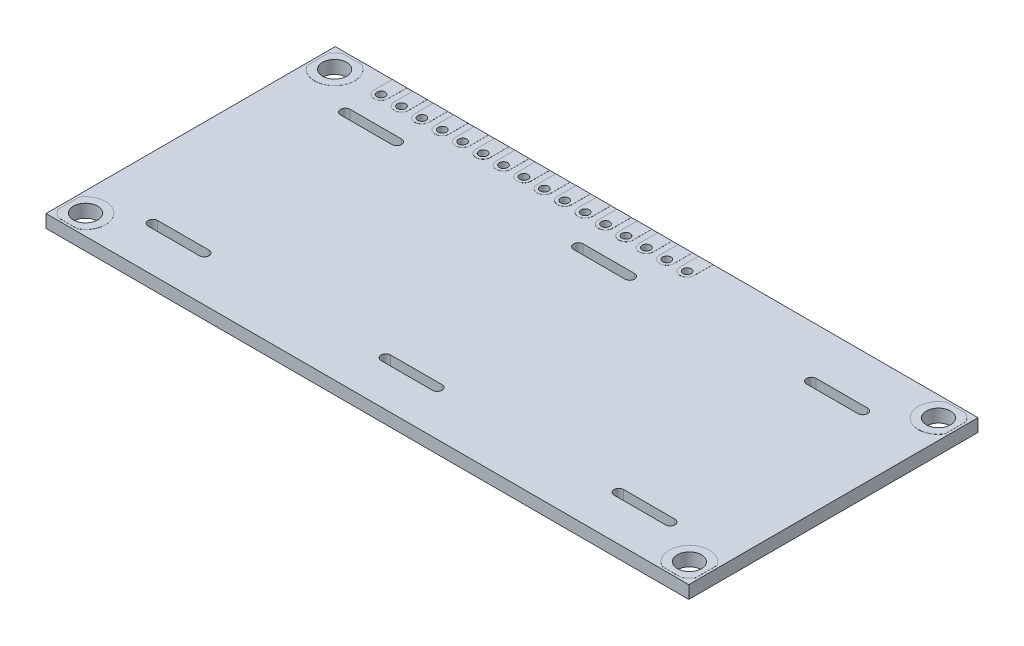
from build123d import *

# Parameters (mm, degrees)
ESQUISSE1_W        = 80
ESQUISSE1_H        = 36
ESQUISSE1_R        = 1.5
ESQUISSE1_R_2      = 0.52
BOSS_EXTRU_1_DEPTH = 1.6
ESQUISSE2_R        = 1.5
ESQUISSE2_R_2      = 0.52
BOSS_EXTRU_2_DEPTH = 0.01
BOSS_EXTRU_3_START = -1.61
ESQUISSE2_2_R      = 1.5
ESQUISSE2_2_R_2    = 0.52
BOSS_EXTRU_3_DEPTH = 0.01


with BuildPart() as part:
    # Esquisse1 → Boss.-Extru.1 (new body)
    with BuildSketch(Plane(origin=(0, 0, 0), x_dir=(1, 0, 0), z_dir=(0, 1, 0))):
        with Locations((40, 18)):
            Rectangle(ESQUISSE1_W, ESQUISSE1_H)
        with Locations(Location((2.42, 33.5, 0), (0, 0, 270))):
            Circle(ESQUISSE1_R, mode=Mode.SUBTRACT)
        with Locations(Location((2.42, 2.5, 0), (0, 0, 90))):
            Circle(ESQUISSE1_R, mode=Mode.SUBTRACT)
        with Locations(Location((77.58, 2.5, 0), (0, 0, 270))):
            Circle(ESQUISSE1_R, mode=Mode.SUBTRACT)
        with Locations(Location((77.58, 33.5, 0), (0, 0, 90))):
            Circle(ESQUISSE1_R, mode=Mode.SUBTRACT)
        with Locations(Location((8.02, 33.68, 0), (0, 0, 270))):
            Circle(ESQUISSE1_R_2, mode=Mode.SUBTRACT)
        with Locations(Location((10.56, 33.68, 0), (0, 0, 270))):
            Circle(ESQUISSE1_R_2, mode=Mode.SUBTRACT)
        with Locations(Location((13.1, 33.68, 0), (0, 0, 270))):
            Circle(ESQUISSE1_R_2, mode=Mode.SUBTRACT)
        with Locations(Location((15.64, 33.68, 0), (0, 0, 270))):
            Circle(ESQUISSE1_R_2, mode=Mode.SUBTRACT)
        with Locations(Location((18.18, 33.68, 0), (0, 0, 270))):
            Circle(ESQUISSE1_R_2, mode=Mode.SUBTRACT)
        with Locations(Location((20.72, 33.68, 0), (0, 0, 270))):
            Circle(ESQUISSE1_R_2, mode=Mode.SUBTRACT)
        with Locations(Location((23.26, 33.68, 0), (0, 0, 270))):
            Circle(ESQUISSE1_R_2, mode=Mode.SUBTRACT)
        with Locations(Location((25.8, 33.68, 0), (0, 0, 270))):
            Circle(ESQUISSE1_R_2, mode=Mode.SUBTRACT)
        with Locations(Location((28.34, 33.68, 0), (0, 0, 270))):
            Circle(ESQUISSE1_R_2, mode=Mode.SUBTRACT)
        with Locations(Location((30.88, 33.68, 0), (0, 0, 270))):
            Circle(ESQUISSE1_R_2, mode=Mode.SUBTRACT)
        with Locations(Location((33.42, 33.68, 0), (0, 0, 270))):
            Circle(ESQUISSE1_R_2, mode=Mode.SUBTRACT)
        with Locations(Location((35.96, 33.68, 0), (0, 0, 270))):
            Circle(ESQUISSE1_R_2, mode=Mode.SUBTRACT)
        with Locations(Location((38.5, 33.68, 0), (0, 0, 270))):
            Circle(ESQUISSE1_R_2, mode=Mode.SUBTRACT)
        with Locations(Location((41.04, 33.68, 0), (0, 0, 270))):
            Circle(ESQUISSE1_R_2, mode=Mode.SUBTRACT)
        with Locations(Location((43.58, 33.68, 0), (0, 0, 270))):
            Circle(ESQUISSE1_R_2, mode=Mode.SUBTRACT)
        with Locations(Location((46.12, 33.68, 0), (0, 0, 270))):
            Circle(ESQUISSE1_R_2, mode=Mode.SUBTRACT)
        with BuildLine():
            Line((7.7, 30.16), (14.1, 30.16))
            ThreePointArc((14.1, 30.16), (14.7, 29.56), (14.1, 28.96))
            Line((14.1, 28.96), (7.7, 28.96))
            ThreePointArc((7.7, 28.96), (7.1, 29.56), (7.7, 30.16))
        make_face(mode=Mode.SUBTRACT)
        with BuildLine():
            Line((7.7, 6.2), (14.1, 6.2))
            ThreePointArc((14.1, 6.2), (14.7, 5.6), (14.1, 5))
            Line((14.1, 5), (7.7, 5))
            ThreePointArc((7.7, 5), (7.1, 5.6), (7.7, 6.2))
        make_face(mode=Mode.SUBTRACT)
        with BuildLine():
            Line((36.7, 30.16), (43.1, 30.16))
            ThreePointArc((43.1, 30.16), (43.7, 29.56), (43.1, 28.96))
            Line((43.1, 28.96), (36.7, 28.96))
            ThreePointArc((36.7, 28.96), (36.1, 29.56), (36.7, 30.16))
        make_face(mode=Mode.SUBTRACT)
        with BuildLine():
            Line((36.7, 6.2), (43.1, 6.2))
            ThreePointArc((43.1, 6.2), (43.7, 5.6), (43.1, 5))
            Line((43.1, 5), (36.7, 5))
            ThreePointArc((36.7, 5), (36.1, 5.6), (36.7, 6.2))
        make_face(mode=Mode.SUBTRACT)
        with BuildLine():
            Line((65.7, 30.16), (72.1, 30.16))
            ThreePointArc((72.1, 30.16), (72.7, 29.56), (72.1, 28.96))
            Line((72.1, 28.96), (65.7, 28.96))
            ThreePointArc((65.7, 28.96), (65.1, 29.56), (65.7, 30.16))
        make_face(mode=Mode.SUBTRACT)
        with BuildLine():
            Line((65.7, 6.2), (72.1, 6.2))
            ThreePointArc((72.1, 6.2), (72.7, 5.6), (72.1, 5))
            Line((72.1, 5), (65.7, 5))
            ThreePointArc((65.7, 5), (65.1, 5.6), (65.7, 6.2))
        make_face(mode=Mode.SUBTRACT)
    extrude(amount=BOSS_EXTRU_1_DEPTH)

    # Esquisse2 → Boss.-Extru.2 (add)
    # profile 1 of 20: a face of its own
    with BuildSketch(Plane(origin=(0, 1.6, 0), x_dir=(1, 0, 0), z_dir=(0, 1, 0))):
        with BuildLine():
            Line((0.3, 32.175009434), (0.3, 34.824990566))
            ThreePointArc((0.3, 34.824990566), (0.709388811, 35.323131745), (1.232565791, 35.7))
            Line((1.232565791, 35.7), (3.607434209, 35.7))
            ThreePointArc((3.607434209, 35.7), (4.243131745, 31.789388811), (0.3, 32.175009434))
        make_face()
        with Locations(Location((2.42, 33.5, 0), (0, 0, 270))):
            Circle(ESQUISSE2_R, mode=Mode.SUBTRACT)
    # profile 2 of 20: a face of its own
    with BuildSketch(Plane(origin=(0, 1.6, 0), x_dir=(1, 0, 0), z_dir=(0, 1, 0))):
        with BuildLine():
            Line((7.12, 33.68), (7.12, 36))
            Line((7.12, 36), (8.92, 36))
            Line((8.92, 36), (8.92, 33.68))
            ThreePointArc((8.92, 33.68), (8.02, 32.78), (7.12, 33.68))
        make_face()
        with Locations(Location((8.02, 33.68, 0), (0, 0, 270))):
            Circle(ESQUISSE2_R_2, mode=Mode.SUBTRACT)
    # profile 3 of 20: a face of its own
    with BuildSketch(Plane(origin=(0, 1.6, 0), x_dir=(1, 0, 0), z_dir=(0, 1, 0))):
        with BuildLine():
            Line((3.607434209, 0.3), (1.232565791, 0.3))
            ThreePointArc((1.232565791, 0.3), (0.709388811, 0.676868255), (0.3, 1.175009434))
            Line((0.3, 1.175009434), (0.3, 3.824990566))
            ThreePointArc((0.3, 3.824990566), (4.243131745, 4.210611189), (3.607434209, 0.3))
        make_face()
        with Locations(Location((2.42, 2.5, 0), (0, 0, 90))):
            Circle(ESQUISSE2_R, mode=Mode.SUBTRACT)
    # profile 4 of 20: a face of its own
    with BuildSketch(Plane(origin=(0, 1.6, 0), x_dir=(1, 0, 0), z_dir=(0, 1, 0))):
        with BuildLine():
            Line((76.392565791, 0.3), (78.767434209, 0.3))
            ThreePointArc((78.767434209, 0.3), (79.290611189, 0.676868255), (79.7, 1.175009434))
            Line((79.7, 1.175009434), (79.7, 3.824990566))
            ThreePointArc((79.7, 3.824990566), (75.756868255, 4.210611189), (76.392565791, 0.3))
        make_face()
        with Locations(Location((77.58, 2.5, 0), (0, 0, 270))):
            Circle(ESQUISSE2_R, mode=Mode.SUBTRACT)
    # profile 5 of 20: a face of its own
    with BuildSketch(Plane(origin=(0, 1.6, 0), x_dir=(1, 0, 0), z_dir=(0, 1, 0))):
        with BuildLine():
            Line((79.7, 32.175009434), (79.7, 34.824990566))
            ThreePointArc((79.7, 34.824990566), (79.290611189, 35.323131745), (78.767434209, 35.7))
            Line((78.767434209, 35.7), (76.392565791, 35.7))
            ThreePointArc((76.392565791, 35.7), (75.756868255, 31.789388811), (79.7, 32.175009434))
        make_face()
        with Locations(Location((77.58, 33.5, 0), (0, 0, 90))):
            Circle(ESQUISSE2_R, mode=Mode.SUBTRACT)
    # profile 6 of 20: a face of its own
    with BuildSketch(Plane(origin=(0, 1.6, 0), x_dir=(1, 0, 0), z_dir=(0, 1, 0))):
        with BuildLine():
            Line((9.66, 33.68), (9.66, 36))
            Line((9.66, 36), (11.46, 36))
            Line((11.46, 36), (11.46, 33.68))
            ThreePointArc((11.46, 33.68), (10.56, 32.78), (9.66, 33.68))
        make_face()
        with Locations(Location((10.56, 33.68, 0), (0, 0, 270))):
            Circle(ESQUISSE2_R_2, mode=Mode.SUBTRACT)
    # profile 7 of 20: a face of its own
    with BuildSketch(Plane(origin=(0, 1.6, 0), x_dir=(1, 0, 0), z_dir=(0, 1, 0))):
        with BuildLine():
            Line((12.2, 33.68), (12.2, 36))
            Line((12.2, 36), (14, 36))
            Line((14, 36), (14, 33.68))
            ThreePointArc((14, 33.68), (13.1, 32.78), (12.2, 33.68))
        make_face()
        with Locations(Location((13.1, 33.68, 0), (0, 0, 270))):
            Circle(ESQUISSE2_R_2, mode=Mode.SUBTRACT)
    # profile 8 of 20: a face of its own
    with BuildSketch(Plane(origin=(0, 1.6, 0), x_dir=(1, 0, 0), z_dir=(0, 1, 0))):
        with BuildLine():
            Line((14.74, 33.68), (14.74, 36))
            Line((14.74, 36), (16.54, 36))
            Line((16.54, 36), (16.54, 33.68))
            ThreePointArc((16.54, 33.68), (15.64, 32.78), (14.74, 33.68))
        make_face()
        with Locations(Location((15.64, 33.68, 0), (0, 0, 270))):
            Circle(ESQUISSE2_R_2, mode=Mode.SUBTRACT)
    # profile 9 of 20: a face of its own
    with BuildSketch(Plane(origin=(0, 1.6, 0), x_dir=(1, 0, 0), z_dir=(0, 1, 0))):
        with BuildLine():
            Line((17.28, 33.68), (17.28, 36))
            Line((17.28, 36), (19.08, 36))
            Line((19.08, 36), (19.08, 33.68))
            ThreePointArc((19.08, 33.68), (18.18, 32.78), (17.28, 33.68))
        make_face()
        with Locations(Location((18.18, 33.68, 0), (0, 0, 270))):
            Circle(ESQUISSE2_R_2, mode=Mode.SUBTRACT)
    # profile 10 of 20: a face of its own
    with BuildSketch(Plane(origin=(0, 1.6, 0), x_dir=(1, 0, 0), z_dir=(0, 1, 0))):
        with BuildLine():
            Line((19.82, 33.68), (19.82, 36))
            Line((19.82, 36), (21.62, 36))
            Line((21.62, 36), (21.62, 33.68))
            ThreePointArc((21.62, 33.68), (20.72, 32.78), (19.82, 33.68))
        make_face()
        with Locations(Location((20.72, 33.68, 0), (0, 0, 270))):
            Circle(ESQUISSE2_R_2, mode=Mode.SUBTRACT)
    # profile 11 of 20: a face of its own
    with BuildSketch(Plane(origin=(0, 1.6, 0), x_dir=(1, 0, 0), z_dir=(0, 1, 0))):
        with BuildLine():
            Line((22.36, 33.68), (22.36, 36))
            Line((22.36, 36), (24.16, 36))
            Line((24.16, 36), (24.16, 33.68))
            ThreePointArc((24.16, 33.68), (23.26, 32.78), (22.36, 33.68))
        make_face()
        with Locations(Location((23.26, 33.68, 0), (0, 0, 270))):
            Circle(ESQUISSE2_R_2, mode=Mode.SUBTRACT)
    # profile 12 of 20: a face of its own
    with BuildSketch(Plane(origin=(0, 1.6, 0), x_dir=(1, 0, 0), z_dir=(0, 1, 0))):
        with BuildLine():
            Line((24.9, 33.68), (24.9, 36))
            Line((24.9, 36), (26.7, 36))
            Line((26.7, 36), (26.7, 33.68))
            ThreePointArc((26.7, 33.68), (25.8, 32.78), (24.9, 33.68))
        make_face()
        with Locations(Location((25.8, 33.68, 0), (0, 0, 270))):
            Circle(ESQUISSE2_R_2, mode=Mode.SUBTRACT)
    # profile 13 of 20: a face of its own
    with BuildSketch(Plane(origin=(0, 1.6, 0), x_dir=(1, 0, 0), z_dir=(0, 1, 0))):
        with BuildLine():
            Line((27.44, 33.68), (27.44, 36))
            Line((27.44, 36), (29.24, 36))
            Line((29.24, 36), (29.24, 33.68))
            ThreePointArc((29.24, 33.68), (28.34, 32.78), (27.44, 33.68))
        make_face()
        with Locations(Location((28.34, 33.68, 0), (0, 0, 270))):
            Circle(ESQUISSE2_R_2, mode=Mode.SUBTRACT)
    # profile 14 of 20: a face of its own
    with BuildSketch(Plane(origin=(0, 1.6, 0), x_dir=(1, 0, 0), z_dir=(0, 1, 0))):
        with BuildLine():
            Line((29.98, 33.68), (29.98, 36))
            Line((29.98, 36), (31.78, 36))
            Line((31.78, 36), (31.78, 33.68))
            ThreePointArc((31.78, 33.68), (30.88, 32.78), (29.98, 33.68))
        make_face()
        with Locations(Location((30.88, 33.68, 0), (0, 0, 270))):
            Circle(ESQUISSE2_R_2, mode=Mode.SUBTRACT)
    # profile 15 of 20: a face of its own
    with BuildSketch(Plane(origin=(0, 1.6, 0), x_dir=(1, 0, 0), z_dir=(0, 1, 0))):
        with BuildLine():
            Line((32.52, 33.68), (32.52, 36))
            Line((32.52, 36), (34.32, 36))
            Line((34.32, 36), (34.32, 33.68))
            ThreePointArc((34.32, 33.68), (33.42, 32.78), (32.52, 33.68))
        make_face()
        with Locations(Location((33.42, 33.68, 0), (0, 0, 270))):
            Circle(ESQUISSE2_R_2, mode=Mode.SUBTRACT)
    # profile 16 of 20: a face of its own
    with BuildSketch(Plane(origin=(0, 1.6, 0), x_dir=(1, 0, 0), z_dir=(0, 1, 0))):
        with BuildLine():
            Line((35.06, 33.68), (35.06, 36))
            Line((35.06, 36), (36.86, 36))
            Line((36.86, 36), (36.86, 33.68))
            ThreePointArc((36.86, 33.68), (35.96, 32.78), (35.06, 33.68))
        make_face()
        with Locations(Location((35.96, 33.68, 0), (0, 0, 270))):
            Circle(ESQUISSE2_R_2, mode=Mode.SUBTRACT)
    # profile 17 of 20: a face of its own
    with BuildSketch(Plane(origin=(0, 1.6, 0), x_dir=(1, 0, 0), z_dir=(0, 1, 0))):
        with BuildLine():
            Line((37.6, 33.68), (37.6, 36))
            Line((37.6, 36), (39.4, 36))
            Line((39.4, 36), (39.4, 33.68))
            ThreePointArc((39.4, 33.68), (38.5, 32.78), (37.6, 33.68))
        make_face()
        with Locations(Location((38.5, 33.68, 0), (0, 0, 270))):
            Circle(ESQUISSE2_R_2, mode=Mode.SUBTRACT)
    # profile 18 of 20: a face of its own
    with BuildSketch(Plane(origin=(0, 1.6, 0), x_dir=(1, 0, 0), z_dir=(0, 1, 0))):
        with BuildLine():
            Line((40.14, 33.68), (40.14, 36))
            Line((40.14, 36), (41.94, 36))
            Line((41.94, 36), (41.94, 33.68))
            ThreePointArc((41.94, 33.68), (41.04, 32.78), (40.14, 33.68))
        make_face()
        with Locations(Location((41.04, 33.68, 0), (0, 0, 270))):
            Circle(ESQUISSE2_R_2, mode=Mode.SUBTRACT)
    # profile 19 of 20: a face of its own
    with BuildSketch(Plane(origin=(0, 1.6, 0), x_dir=(1, 0, 0), z_dir=(0, 1, 0))):
        with BuildLine():
            Line((42.68, 33.68), (42.68, 36))
            Line((42.68, 36), (44.48, 36))
            Line((44.48, 36), (44.48, 33.68))
            ThreePointArc((44.48, 33.68), (43.58, 32.78), (42.68, 33.68))
        make_face()
        with Locations(Location((43.58, 33.68, 0), (0, 0, 270))):
            Circle(ESQUISSE2_R_2, mode=Mode.SUBTRACT)
    # profile 20 of 20: a face of its own
    with BuildSketch(Plane(origin=(0, 1.6, 0), x_dir=(1, 0, 0), z_dir=(0, 1, 0))):
        with BuildLine():
            Line((45.22, 33.68), (45.22, 36))
            Line((45.22, 36), (47.02, 36))
            Line((47.02, 36), (47.02, 33.68))
            ThreePointArc((47.02, 33.68), (46.12, 32.78), (45.22, 33.68))
        make_face()
        with Locations(Location((46.12, 33.68, 0), (0, 0, 270))):
            Circle(ESQUISSE2_R_2, mode=Mode.SUBTRACT)
    extrude(amount=BOSS_EXTRU_2_DEPTH)

    # Esquisse2<2> → Boss.-Extru.3 (add)
    # profile 1 of 20: a face of its own
    with BuildSketch(Plane(origin=(0, 1.6, 0), x_dir=(1, 0, 0), z_dir=(0, 1, 0)).offset(BOSS_EXTRU_3_START)):
        with BuildLine():
            Line((0.3, 32.175009434), (0.3, 34.824990566))
            ThreePointArc((0.3, 34.824990566), (0.709388811, 35.323131745), (1.232565791, 35.7))
            Line((1.232565791, 35.7), (3.607434209, 35.7))
            ThreePointArc((3.607434209, 35.7), (4.243131745, 31.789388811), (0.3, 32.175009434))
        make_face()
        with Locations(Location((2.42, 33.5, 0), (0, 0, 90))):
            Circle(ESQUISSE2_2_R, mode=Mode.SUBTRACT)
    # profile 2 of 20: a face of its own
    with BuildSketch(Plane(origin=(0, 1.6, 0), x_dir=(1, 0, 0), z_dir=(0, 1, 0)).offset(BOSS_EXTRU_3_START)):
        with BuildLine():
            Line((7.12, 33.68), (7.12, 36))
            Line((7.12, 36), (8.92, 36))
            Line((8.92, 36), (8.92, 33.68))
            ThreePointArc((8.92, 33.68), (8.02, 32.78), (7.12, 33.68))
        make_face()
        with Locations(Location((8.02, 33.68, 0), (0, 0, 90))):
            Circle(ESQUISSE2_2_R_2, mode=Mode.SUBTRACT)
    # profile 3 of 20: a face of its own
    with BuildSketch(Plane(origin=(0, 1.6, 0), x_dir=(1, 0, 0), z_dir=(0, 1, 0)).offset(BOSS_EXTRU_3_START)):
        with BuildLine():
            Line((3.607434209, 0.3), (1.232565791, 0.3))
            ThreePointArc((1.232565791, 0.3), (0.709388811, 0.676868255), (0.3, 1.175009434))
            Line((0.3, 1.175009434), (0.3, 3.824990566))
            ThreePointArc((0.3, 3.824990566), (4.243131745, 4.210611189), (3.607434209, 0.3))
        make_face()
        with Locations(Location((2.42, 2.5, 0), (0, 0, 90))):
            Circle(ESQUISSE2_2_R, mode=Mode.SUBTRACT)
    # profile 4 of 20: a face of its own
    with BuildSketch(Plane(origin=(0, 1.6, 0), x_dir=(1, 0, 0), z_dir=(0, 1, 0)).offset(BOSS_EXTRU_3_START)):
        with BuildLine():
            Line((76.392565791, 0.3), (78.767434209, 0.3))
            ThreePointArc((78.767434209, 0.3), (79.290611189, 0.676868255), (79.7, 1.175009434))
            Line((79.7, 1.175009434), (79.7, 3.824990566))
            ThreePointArc((79.7, 3.824990566), (75.756868255, 4.210611189), (76.392565791, 0.3))
        make_face()
        with Locations(Location((77.58, 2.5, 0), (0, 0, 90))):
            Circle(ESQUISSE2_2_R, mode=Mode.SUBTRACT)
    # profile 5 of 20: a face of its own
    with BuildSketch(Plane(origin=(0, 1.6, 0), x_dir=(1, 0, 0), z_dir=(0, 1, 0)).offset(BOSS_EXTRU_3_START)):
        with BuildLine():
            Line((79.7, 32.175009434), (79.7, 34.824990566))
            ThreePointArc((79.7, 34.824990566), (79.290611189, 35.323131745), (78.767434209, 35.7))
            Line((78.767434209, 35.7), (76.392565791, 35.7))
            ThreePointArc((76.392565791, 35.7), (75.756868255, 31.789388811), (79.7, 32.175009434))
        make_face()
        with Locations(Location((77.58, 33.5, 0), (0, 0, 90))):
            Circle(ESQUISSE2_2_R, mode=Mode.SUBTRACT)
    # profile 6 of 20: a face of its own
    with BuildSketch(Plane(origin=(0, 1.6, 0), x_dir=(1, 0, 0), z_dir=(0, 1, 0)).offset(BOSS_EXTRU_3_START)):
        with BuildLine():
            Line((9.66, 33.68), (9.66, 36))
            Line((9.66, 36), (11.46, 36))
            Line((11.46, 36), (11.46, 33.68))
            ThreePointArc((11.46, 33.68), (10.56, 32.78), (9.66, 33.68))
        make_face()
        with Locations(Location((10.56, 33.68, 0), (0, 0, 90))):
            Circle(ESQUISSE2_2_R_2, mode=Mode.SUBTRACT)
    # profile 7 of 20: a face of its own
    with BuildSketch(Plane(origin=(0, 1.6, 0), x_dir=(1, 0, 0), z_dir=(0, 1, 0)).offset(BOSS_EXTRU_3_START)):
        with BuildLine():
            Line((12.2, 33.68), (12.2, 36))
            Line((12.2, 36), (14, 36))
            Line((14, 36), (14, 33.68))
            ThreePointArc((14, 33.68), (13.1, 32.78), (12.2, 33.68))
        make_face()
        with Locations(Location((13.1, 33.68, 0), (0, 0, 90))):
            Circle(ESQUISSE2_2_R_2, mode=Mode.SUBTRACT)
    # profile 8 of 20: a face of its own
    with BuildSketch(Plane(origin=(0, 1.6, 0), x_dir=(1, 0, 0), z_dir=(0, 1, 0)).offset(BOSS_EXTRU_3_START)):
        with BuildLine():
            Line((14.74, 33.68), (14.74, 36))
            Line((14.74, 36), (16.54, 36))
            Line((16.54, 36), (16.54, 33.68))
            ThreePointArc((16.54, 33.68), (15.64, 32.78), (14.74, 33.68))
        make_face()
        with Locations(Location((15.64, 33.68, 0), (0, 0, 90))):
            Circle(ESQUISSE2_2_R_2, mode=Mode.SUBTRACT)
    # profile 9 of 20: a face of its own
    with BuildSketch(Plane(origin=(0, 1.6, 0), x_dir=(1, 0, 0), z_dir=(0, 1, 0)).offset(BOSS_EXTRU_3_START)):
        with BuildLine():
            Line((17.28, 33.68), (17.28, 36))
            Line((17.28, 36), (19.08, 36))
            Line((19.08, 36), (19.08, 33.68))
            ThreePointArc((19.08, 33.68), (18.18, 32.78), (17.28, 33.68))
        make_face()
        with Locations(Location((18.18, 33.68, 0), (0, 0, 90))):
            Circle(ESQUISSE2_2_R_2, mode=Mode.SUBTRACT)
    # profile 10 of 20: a face of its own
    with BuildSketch(Plane(origin=(0, 1.6, 0), x_dir=(1, 0, 0), z_dir=(0, 1, 0)).offset(BOSS_EXTRU_3_START)):
        with BuildLine():
            Line((19.82, 33.68), (19.82, 36))
            Line((19.82, 36), (21.62, 36))
            Line((21.62, 36), (21.62, 33.68))
            ThreePointArc((21.62, 33.68), (20.72, 32.78), (19.82, 33.68))
        make_face()
        with Locations(Location((20.72, 33.68, 0), (0, 0, 90))):
            Circle(ESQUISSE2_2_R_2, mode=Mode.SUBTRACT)
    # profile 11 of 20: a face of its own
    with BuildSketch(Plane(origin=(0, 1.6, 0), x_dir=(1, 0, 0), z_dir=(0, 1, 0)).offset(BOSS_EXTRU_3_START)):
        with BuildLine():
            Line((22.36, 33.68), (22.36, 36))
            Line((22.36, 36), (24.16, 36))
            Line((24.16, 36), (24.16, 33.68))
            ThreePointArc((24.16, 33.68), (23.26, 32.78), (22.36, 33.68))
        make_face()
        with Locations(Location((23.26, 33.68, 0), (0, 0, 90))):
            Circle(ESQUISSE2_2_R_2, mode=Mode.SUBTRACT)
    # profile 12 of 20: a face of its own
    with BuildSketch(Plane(origin=(0, 1.6, 0), x_dir=(1, 0, 0), z_dir=(0, 1, 0)).offset(BOSS_EXTRU_3_START)):
        with BuildLine():
            Line((24.9, 33.68), (24.9, 36))
            Line((24.9, 36), (26.7, 36))
            Line((26.7, 36), (26.7, 33.68))
            ThreePointArc((26.7, 33.68), (25.8, 32.78), (24.9, 33.68))
        make_face()
        with Locations(Location((25.8, 33.68, 0), (0, 0, 90))):
            Circle(ESQUISSE2_2_R_2, mode=Mode.SUBTRACT)
    # profile 13 of 20: a face of its own
    with BuildSketch(Plane(origin=(0, 1.6, 0), x_dir=(1, 0, 0), z_dir=(0, 1, 0)).offset(BOSS_EXTRU_3_START)):
        with BuildLine():
            Line((27.44, 33.68), (27.44, 36))
            Line((27.44, 36), (29.24, 36))
            Line((29.24, 36), (29.24, 33.68))
            ThreePointArc((29.24, 33.68), (28.34, 32.78), (27.44, 33.68))
        make_face()
        with Locations(Location((28.34, 33.68, 0), (0, 0, 90))):
            Circle(ESQUISSE2_2_R_2, mode=Mode.SUBTRACT)
    # profile 14 of 20: a face of its own
    with BuildSketch(Plane(origin=(0, 1.6, 0), x_dir=(1, 0, 0), z_dir=(0, 1, 0)).offset(BOSS_EXTRU_3_START)):
        with BuildLine():
            Line((29.98, 33.68), (29.98, 36))
            Line((29.98, 36), (31.78, 36))
            Line((31.78, 36), (31.78, 33.68))
            ThreePointArc((31.78, 33.68), (30.88, 32.78), (29.98, 33.68))
        make_face()
        with Locations(Location((30.88, 33.68, 0), (0, 0, 90))):
            Circle(ESQUISSE2_2_R_2, mode=Mode.SUBTRACT)
    # profile 15 of 20: a face of its own
    with BuildSketch(Plane(origin=(0, 1.6, 0), x_dir=(1, 0, 0), z_dir=(0, 1, 0)).offset(BOSS_EXTRU_3_START)):
        with BuildLine():
            Line((32.52, 33.68), (32.52, 36))
            Line((32.52, 36), (34.32, 36))
            Line((34.32, 36), (34.32, 33.68))
            ThreePointArc((34.32, 33.68), (33.42, 32.78), (32.52, 33.68))
        make_face()
        with Locations(Location((33.42, 33.68, 0), (0, 0, 90))):
            Circle(ESQUISSE2_2_R_2, mode=Mode.SUBTRACT)
    # profile 16 of 20: a face of its own
    with BuildSketch(Plane(origin=(0, 1.6, 0), x_dir=(1, 0, 0), z_dir=(0, 1, 0)).offset(BOSS_EXTRU_3_START)):
        with BuildLine():
            Line((35.06, 33.68), (35.06, 36))
            Line((35.06, 36), (36.86, 36))
            Line((36.86, 36), (36.86, 33.68))
            ThreePointArc((36.86, 33.68), (35.96, 32.78), (35.06, 33.68))
        make_face()
        with Locations(Location((35.96, 33.68, 0), (0, 0, 90))):
            Circle(ESQUISSE2_2_R_2, mode=Mode.SUBTRACT)
    # profile 17 of 20: a face of its own
    with BuildSketch(Plane(origin=(0, 1.6, 0), x_dir=(1, 0, 0), z_dir=(0, 1, 0)).offset(BOSS_EXTRU_3_START)):
        with BuildLine():
            Line((37.6, 33.68), (37.6, 36))
            Line((37.6, 36), (39.4, 36))
            Line((39.4, 36), (39.4, 33.68))
            ThreePointArc((39.4, 33.68), (38.5, 32.78), (37.6, 33.68))
        make_face()
        with Locations(Location((38.5, 33.68, 0), (0, 0, 90))):
            Circle(ESQUISSE2_2_R_2, mode=Mode.SUBTRACT)
    # profile 18 of 20: a face of its own
    with BuildSketch(Plane(origin=(0, 1.6, 0), x_dir=(1, 0, 0), z_dir=(0, 1, 0)).offset(BOSS_EXTRU_3_START)):
        with BuildLine():
            Line((40.14, 33.68), (40.14, 36))
            Line((40.14, 36), (41.94, 36))
            Line((41.94, 36), (41.94, 33.68))
            ThreePointArc((41.94, 33.68), (41.04, 32.78), (40.14, 33.68))
        make_face()
        with Locations(Location((41.04, 33.68, 0), (0, 0, 90))):
            Circle(ESQUISSE2_2_R_2, mode=Mode.SUBTRACT)
    # profile 19 of 20: a face of its own
    with BuildSketch(Plane(origin=(0, 1.6, 0), x_dir=(1, 0, 0), z_dir=(0, 1, 0)).offset(BOSS_EXTRU_3_START)):
        with BuildLine():
            Line((42.68, 33.68), (42.68, 36))
            Line((42.68, 36), (44.48, 36))
            Line((44.48, 36), (44.48, 33.68))
            ThreePointArc((44.48, 33.68), (43.58, 32.78), (42.68, 33.68))
        make_face()
        with Locations(Location((43.58, 33.68, 0), (0, 0, 90))):
            Circle(ESQUISSE2_2_R_2, mode=Mode.SUBTRACT)
    # profile 20 of 20: a face of its own
    with BuildSketch(Plane(origin=(0, 1.6, 0), x_dir=(1, 0, 0), z_dir=(0, 1, 0)).offset(BOSS_EXTRU_3_START)):
        with BuildLine():
            Line((45.22, 33.68), (45.22, 36))
            Line((45.22, 36), (47.02, 36))
            Line((47.02, 36), (47.02, 33.68))
            ThreePointArc((47.02, 33.68), (46.12, 32.78), (45.22, 33.68))
        make_face()
        with Locations(Location((46.12, 33.68, 0), (0, 0, 90))):
            Circle(ESQUISSE2_2_R_2, mode=Mode.SUBTRACT)
    extrude(amount=BOSS_EXTRU_3_DEPTH)

    # Esquisse3 → Révolution1 (revolve)
    with BuildSketch(Plane(origin=(0, 0, -18), x_dir=(-1, 0, 0), z_dir=(0, 0, -1))):
        with BuildLine():
            Line((-54, 0), (-54, -1.2))
            ThreePointArc((-54, -1.2), (-51.06347805, -0.894792675), (-48.25, 0))
            Line((-48.25, 0), (-54, 0))
        make_face()
    revolve(axis=Axis((54, -12.033839249, -18), (0, 1, 0)))

    # Esquisse3<6> → Révolution2 (revolve)
    with BuildSketch(Plane(origin=(0, 0, -18), x_dir=(-1, 0, 0), z_dir=(0, 0, -1))):
        with BuildLine():
            Line((-27.5, 0), (-27.5, -1.2))
            ThreePointArc((-27.5, -1.2), (-24.072081535, -0.897666363), (-20.75, 0))
            Line((-20.75, 0), (-27.5, 0))
        make_face()
    revolve(axis=Axis((27.5, 0, -18), (0, -1, 0)))


solid = part.part
